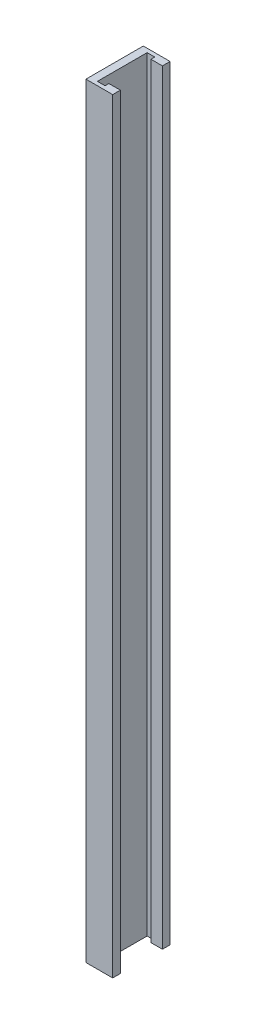
from build123d import *

# Parameters (mm, degrees)
CROQUIS1_W              = 15
CROQUIS1_H              = 200
SALIENTE_EXTRUIR1_DEPTH = 7
CORTAR_EXTRUIR1_DEPTH   = 201.593371852


with BuildPart() as part:
    # Croquis1 → Saliente-Extruir1 (new body)
    with BuildSketch(Plane(origin=(0, 0, 0), x_dir=(0, 0, -1), z_dir=(1, 0, 0))):
        with Locations((-6.236842105, -71.973684211)):
            Rectangle(CROQUIS1_W, CROQUIS1_H)
    extrude(amount=SALIENTE_EXTRUIR1_DEPTH)

    # Croquis2 → Cortar-Extruir1 (cut, through all)
    with BuildSketch(Plane(origin=(0, 28.026315789, 0), x_dir=(1, 0, 0), z_dir=(0, 1, 0))):
        Polygon((7, -0.736842105), (4, -0.736842105), (4, 0.263157895), (2, 0.263157895), (2, -12.736842105), (4, -12.736842105), (4, -11.736842105), (7, -11.736842105), align=None)
    extrude(amount=-CORTAR_EXTRUIR1_DEPTH, mode=Mode.SUBTRACT)


solid = part.part
